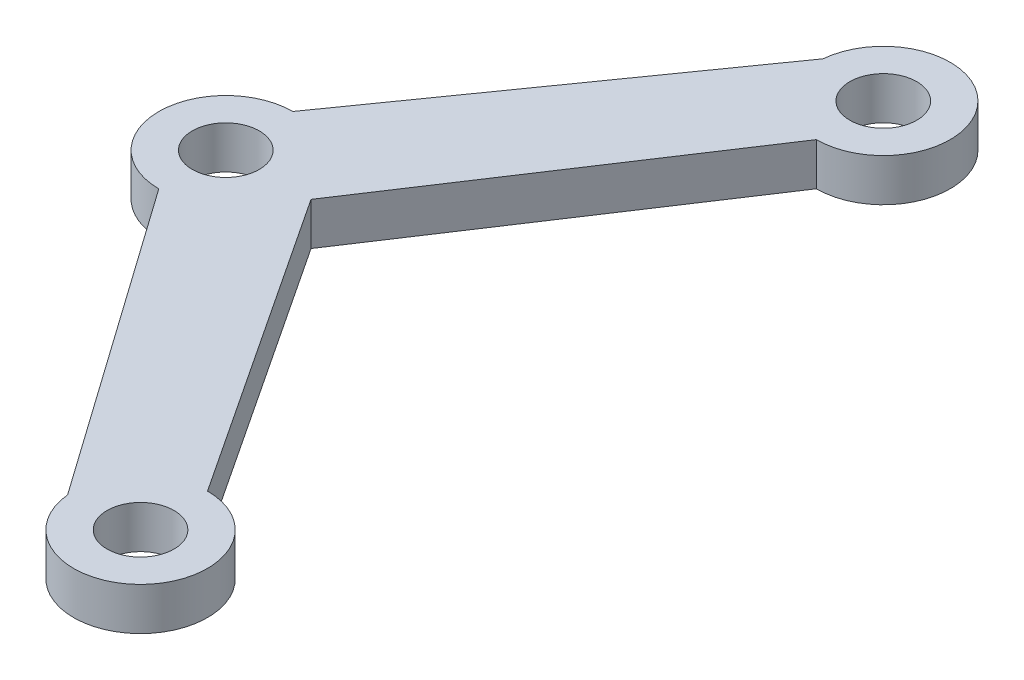
from build123d import *

# Parameters (mm, degrees)
SKETCH2_R           = 1.375
BOSS_EXTRUDE1_DEPTH = 1.75


with BuildPart() as part:
    # Sketch2 → Boss-Extrude1 (new body)
    with BuildSketch(Plane(origin=(0, 0, 0), x_dir=(1, 0, 0), z_dir=(0, 1, 0))):
        with BuildLine():
            Line((-27, -2.75), (-17.987773433, -15.509030166))
            ThreePointArc((-17.987773433, -15.509030166), (-13.21593597, -17.100698117), (-15.25, -12.5))
            Line((-15.25, -12.5), (-23.5, 0))
            Line((-23.5, 0), (-15.25, 12.5))
            ThreePointArc((-15.25, 12.5), (-13.21593597, 17.100698117), (-17.987773433, 15.509030166))
            Line((-17.987773433, 15.509030166), (-27, 2.75))
            ThreePointArc((-27, 2.75), (-29.75, 0), (-27, -2.75))
        make_face()
        with Locations(Location((-27, 0, 0), (0, 0, 270))):
            Circle(SKETCH2_R, mode=Mode.SUBTRACT)
        with Locations(Location((-15.25, 15.25, 0), (0, 0, 270))):
            Circle(SKETCH2_R, mode=Mode.SUBTRACT)
        with Locations(Location((-15.25, -15.25, 0), (0, 0, 270))):
            Circle(SKETCH2_R, mode=Mode.SUBTRACT)
    extrude(amount=BOSS_EXTRUDE1_DEPTH)


solid = part.part
